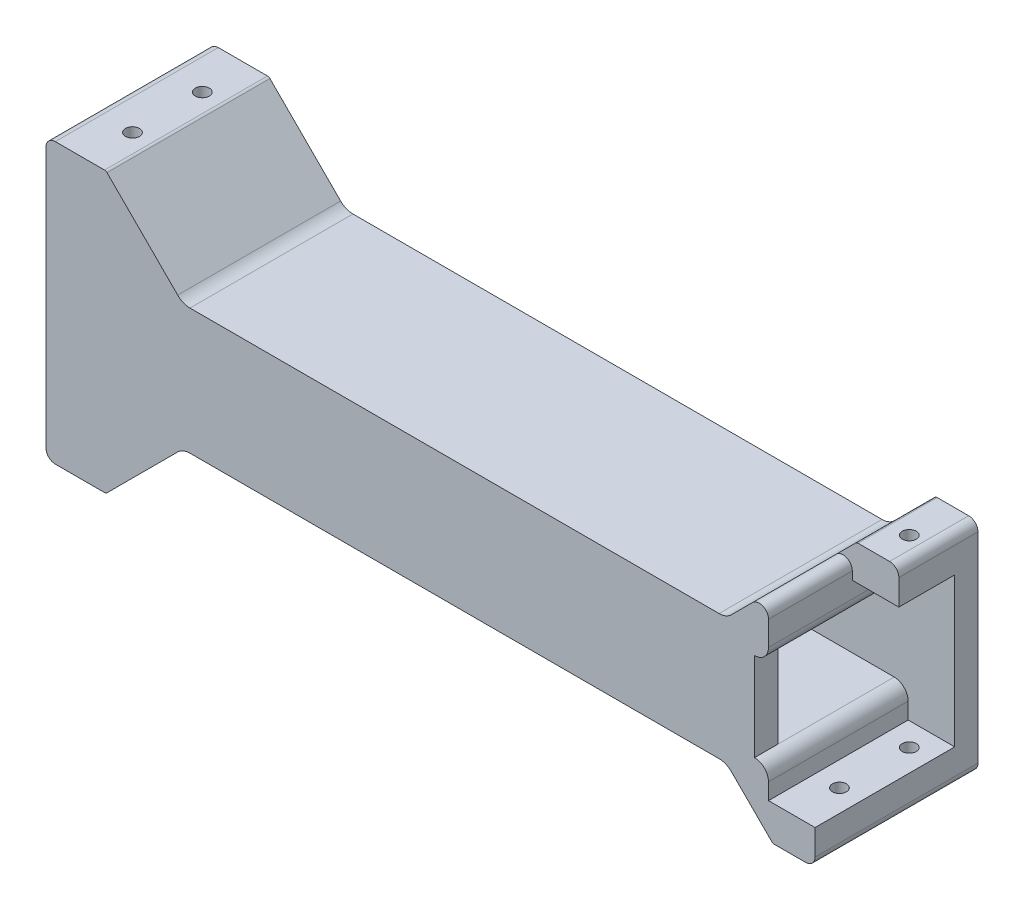
from build123d import *

# Parameters (mm, degrees)
EXTRUDE_1_DEPTH          = 35
SKETCH_3_W               = 25
SKETCH_3_H               = 19
CUT_EXTRUDE_1_DEPTH      = 181.230887126
SKETCH_4_W               = 25
SKETCH_4_H               = 12.5
CUT_EXTRUDE_2_DEPTH      = 13.5
SKETCH_5_W               = 25
SKETCH_5_H               = 32
CUT_EXTRUDE_3_DEPTH      = 10
FILLET_1_R               = 3
FILLET_2_R               = 2
CUT_EXTRUDE_4_DEPTH      = 191.354670013
CUT_EXTRUDE_4_DEPTH_BACK = 191.354670013
SKETCH_6_R               = 1.5
CUT_EXTRUDE_5_DEPTH      = 189.803867534
CUT_EXTRUDE_5_DEPTH_BACK = 189.803867534
SKETCH_7_R               = 1.5
SKETCH_8_W               = 13.5
SKETCH_8_H               = 44
SKETCH_8_W_2             = 10
SKETCH_8_H_2             = 32
CUT_EXTRUDE_6_DEPTH      = 193.807936548
CUT_EXTRUDE_7_DEPTH      = 10
CUT_EXTRUDE_8_DEPTH      = 18
FILLET_3_R               = 2
SKETCH_11_W              = 10
SKETCH_11_H              = 32
EXTRUDE_2_DEPTH          = 5
CUT_EXTRUDE_10_DEPTH     = 5


with BuildPart() as part:
    # 草图1 → 凸台-拉伸1 (new body)
    with BuildSketch(Plane.XY):
        with BuildLine():
            Line((42.832374142, 47.594424801), (27.642544089, 62.784254855))
            ThreePointArc((27.642544089, 62.784254855), (27.40357385, 62.943929664), (27.121689234, 63))
            Line((27.121689234, 63), (14.544073956, 63))
            Line((14.544073956, 63), (14.544073956, 3))
            Line((14.544073956, 3), (27.121689234, 3))
            ThreePointArc((27.121689234, 3), (27.40357385, 3.056070336), (27.642544089, 3.215745145))
            Line((27.642544089, 3.215745145), (42.832374142, 18.405575199))
            ThreePointArc((42.832374142, 18.405575199), (44.044614428, 19.215568261), (45.474549341, 19.5))
            Line((45.474549341, 19.5), (159.121689234, 19.5))
            ThreePointArc((159.121689234, 19.5), (160.551624147, 19.215568261), (161.763864432, 18.405575199))
            Line((161.763864432, 18.405575199), (170.453694486, 9.715745145))
            ThreePointArc((170.453694486, 9.715745145), (170.692664725, 9.556070336), (170.974549341, 9.5))
            Line((170.974549341, 9.5), (179.738422147, 9.5))
            Line((179.738422147, 9.5), (179.738422147, 56.5))
            Line((179.738422147, 56.5), (170.974549341, 56.5))
            ThreePointArc((170.974549341, 56.5), (170.692664725, 56.443929664), (170.453694486, 56.284254855))
            Line((170.453694486, 56.284254855), (161.763864432, 47.594424801))
            ThreePointArc((161.763864432, 47.594424801), (160.551624147, 46.784431739), (159.121689234, 46.5))
            Line((159.121689234, 46.5), (45.474549341, 46.5))
            ThreePointArc((45.474549341, 46.5), (44.044614428, 46.784431739), (42.832374142, 47.594424801))
        make_face()
    extrude(amount=EXTRUDE_1_DEPTH)

    # 草图3 → 切除-拉伸1 (cut, through all)
    with BuildSketch(Plane.ZY.offset(-14.544073956)):
        with Locations((17.5, 33)):
            Rectangle(SKETCH_3_W, SKETCH_3_H)
    extrude(amount=-CUT_EXTRUDE_1_DEPTH, mode=Mode.SUBTRACT)

    # 草图4 → 切除-拉伸2 (cut)
    with BuildSketch(Plane.ZY.offset(-14.544073956)):
        with Locations((17.5, 48.75)):
            Rectangle(SKETCH_4_W, SKETCH_4_H)
        with Locations((17.5, 17.25)):
            Rectangle(SKETCH_4_W, SKETCH_4_H)
    extrude(amount=-CUT_EXTRUDE_2_DEPTH, mode=Mode.SUBTRACT)

    # 草图5 → 切除-拉伸3 (cut)
    with BuildSketch(Plane(origin=(179.738422147, 0, 0), x_dir=(0, 0, -1), z_dir=(1, 0, 0))):
        with Locations((-17.5, 33)):
            Rectangle(SKETCH_5_W, SKETCH_5_H)
    extrude(amount=-CUT_EXTRUDE_3_DEPTH, mode=Mode.SUBTRACT)

    # 圆角1
    fillet_1_edges = [part.edges().sort_by_distance(p)[0] for p in [
        (169.738422147, 23.5, 17.5),
        (169.738422147, 42.5, 17.5),
        (28.044073956, 42.5, 17.5),
        (28.044073956, 23.5, 17.5),
    ]]
    fillet(fillet_1_edges, radius=FILLET_1_R)

    # 圆角2
    fillet_2_edges = [part.edges().sort_by_distance(p)[0] for p in [
        (179.738422147, 56.5, 17.5),
        (179.738422147, 9.5, 17.5),
        (14.544073956, 3, 17.5),
        (14.544073956, 63, 17.5),
    ]]
    fillet(fillet_2_edges, radius=FILLET_2_R)

    # 草图6 → 切除-拉伸4 (cut, two sides: drawn at the far end of the back side and taken through both)
    with BuildSketch(Plane.XZ.offset(-55).offset(-CUT_EXTRUDE_4_DEPTH_BACK)):
        with Locations((23.121689234, 25)):
            Circle(SKETCH_6_R)
        with Locations((23.121689234, 10)):
            Circle(SKETCH_6_R)
    extrude(amount=CUT_EXTRUDE_4_DEPTH + CUT_EXTRUDE_4_DEPTH_BACK, mode=Mode.SUBTRACT)

    # 草图7 → 切除-拉伸5 (cut, two sides: drawn at the far end of the back side and taken through both)
    with BuildSketch(Plane.XZ.offset(-49).offset(-CUT_EXTRUDE_5_DEPTH_BACK)):
        with Locations(Location((174.974549341, 25, 0), (0, 0, 270))):
            Circle(SKETCH_7_R)
        with Locations(Location((174.974549341, 10, 0), (0, 0, 270))):
            Circle(SKETCH_7_R)
    extrude(amount=CUT_EXTRUDE_5_DEPTH + CUT_EXTRUDE_5_DEPTH_BACK, mode=Mode.SUBTRACT)

    # 草图8 → 切除-拉伸6 (cut, through all)
    with BuildSketch(Plane.XY.offset(5)):
        with Locations((21.294073956, 33)):
            Rectangle(SKETCH_8_W, SKETCH_8_H)
        with Locations((174.738422147, 33)):
            Rectangle(SKETCH_8_W_2, SKETCH_8_H_2)
    extrude(amount=-CUT_EXTRUDE_6_DEPTH, mode=Mode.SUBTRACT)

    # 草图9 → 切除-拉伸7 (cut)
    with BuildSketch(Plane(origin=(0, 0, 30), x_dir=(-1, 0, 0), z_dir=(0, 0, -1))):
        Polygon((-169.738422147, 49), (-179.738422147, 49), (-179.738422147, 17), (-169.738422147, 17), (-169.738422147, 20.5), (-169.738422147, 45.5), align=None)
    extrude(amount=-CUT_EXTRUDE_7_DEPTH, mode=Mode.SUBTRACT)

    # 草图10 → 切除-拉伸8 (cut)
    with BuildSketch(Plane.XY.offset(35)):
        with BuildLine():
            Line((169.738422147, 55.568982516), (169.738422147, 49))
            Line((169.738422147, 49), (179.738422147, 49))
            Line((179.738422147, 49), (179.738422147, 54.5))
            ThreePointArc((179.738422147, 54.5), (179.15263571, 55.914213562), (177.738422147, 56.5))
            Line((177.738422147, 56.5), (170.974549341, 56.5))
            ThreePointArc((170.974549341, 56.5), (170.692664725, 56.443929664), (170.453694486, 56.284254855))
            Line((170.453694486, 56.284254855), (169.738422147, 55.568982516))
        make_face()
    extrude(amount=-CUT_EXTRUDE_8_DEPTH, mode=Mode.SUBTRACT)

    # 圆角3
    fillet_3_edges = [part.edges().sort_by_distance(p)[0] for p in [
        (169.738422147, 55.568982516, 26),
    ]]
    fillet(fillet_3_edges, radius=FILLET_3_R)

    # 草图11 → 凸台-拉伸2 (add)
    with BuildSketch(Plane(origin=(0, 0, 0), x_dir=(-1, 0, 0), z_dir=(0, 0, -1))):
        with Locations((-174.738422147, 33)):
            Rectangle(SKETCH_11_W, SKETCH_11_H)
    extrude(amount=-EXTRUDE_2_DEPTH)

    # 草图12 → 切除-拉伸10 (cut)
    with BuildSketch(Plane(origin=(0, 0, 30), x_dir=(-1, 0, 0), z_dir=(0, 0, -1))):
        with BuildLine():
            Line((-166.738422147, 23.5), (-166.738422147, 42.5))
            ThreePointArc((-166.738422147, 42.5), (-168.859742491, 43.378679656), (-169.738422147, 45.5))
            Line((-169.738422147, 45.5), (-169.738422147, 20.5))
            ThreePointArc((-169.738422147, 20.5), (-168.859742491, 22.621320344), (-166.738422147, 23.5))
        make_face()
    extrude(amount=-CUT_EXTRUDE_10_DEPTH, mode=Mode.SUBTRACT)


solid = part.part
